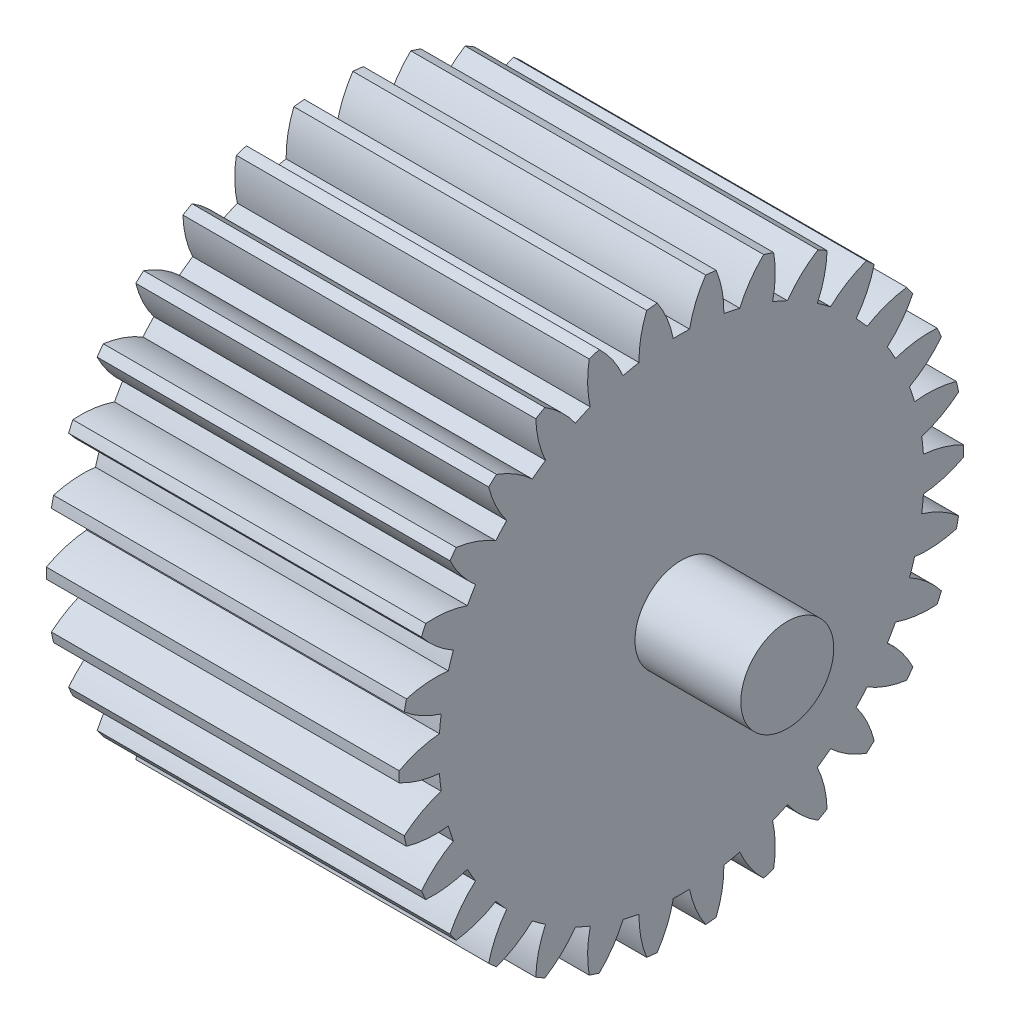
from build123d import *

# Parameters (mm, degrees)
BASPROSKE_W             = 20
BASPROSKE_H             = 24
TOOTHCUT_DEPTH          = 40.395431207
TEETHCUTS_COUNT         = 30
HUBNEABOTSKE_R          = 10
HUBNEARBOTH_DEPTH       = 10.0000254
HUBFAR_START            = 10.0000254
HUBFARSKE_R             = 10
HUBFAR_DEPTH            = 10.0000254
BORSKE_R                = 4
BORE_DEPTH              = 40.0000508
CROQUIS1_R              = 10
CORTAR_EXTRUIR1_DEPTH   = 10.0000254
CROQUIS3_R              = 4
SALIENTE_EXTRUIR1_DEPTH = 30.0000254
CROQUIS4_R              = 3.95
SALIENTE_EXTRUIR2_DEPTH = 9
CROQUIS5_R              = 11.088138116
CORTAR_EXTRUIR2_DEPTH   = 10.0000254
SALIENTE_EXTRUIR3_START = 10
SALIENTE_EXTRUIR3_DEPTH = 10
CROQUIS7_R              = 4
CROQUIS7_R_2            = 1.5
CORTAR_EXTRUIR3_DEPTH   = 10


with BuildPart() as part:
    # BasProSke → Base-Revolve (revolve)
    with BuildSketch(Plane(origin=(0, 0, 0), x_dir=(1, 0, 0), z_dir=(0, 1, 0)), mode=Mode.PRIVATE) as base_revolve_sk:
        with Locations((10, 12)):
            Rectangle(BASPROSKE_W, BASPROSKE_H)
    revolve(base_revolve_sk.sketch.rotate(Axis((-10, 0, 0), (1, 0, 0)), 180), axis=Axis((-10, 0, 0), (1, 0, 0)))

    # TooCutSke → ToothCut (cut, through all)
    with BuildSketch(Plane(origin=(0, 0, 0), x_dir=(0, 0, -1), z_dir=(1, 0, 0))):
        with BuildLine():
            ThreePointArc((0.693278797, 20.612344372), (0, 20.624), (-0.693278797, 20.612344372))
            ThreePointArc((-0.693278797, 20.612344372), (-1.219042225, 22.34383125), (-2.080549663, 23.935144835))
            ThreePointArc((-2.080549663, 23.935144835), (0, 24.0254), (2.080549663, 23.935144835))
            ThreePointArc((2.080549663, 23.935144835), (1.219042225, 22.34383125), (0.693278797, 20.612344372))
        make_face()
    toothcut = extrude(amount=TOOTHCUT_DEPTH, mode=Mode.SUBTRACT)

    # TeethCuts: ToothCut ×30 about axis
    teethcuts_axis = Axis((0, 0, 0), (1, 0, 0))
    for i in range(1, TEETHCUTS_COUNT):
        add(toothcut.rotate(teethcuts_axis, i * 360 / TEETHCUTS_COUNT), mode=Mode.SUBTRACT)

    # HubNeaBotSke → HubNearBoth (add)
    with BuildSketch(Plane.ZY):
        with Locations(Location((0, 0, 0), (0, 0, 180))):
            Circle(HUBNEABOTSKE_R)
    extrude(amount=HUBNEARBOTH_DEPTH)

    # HubFarSke → HubFar (add)
    with BuildSketch(Plane(origin=(20, 0, 0), x_dir=(0, 0, -1), z_dir=(1, 0, 0)).offset(HUBFAR_START)):
        Circle(HUBFARSKE_R)
    extrude(amount=-HUBFAR_DEPTH)

    # BorSke → Bore (cut, symmetric)
    with BuildSketch(Plane(origin=(0, 0, 0), x_dir=(0, 0, -1), z_dir=(1, 0, 0))):
        with Locations(Location((0, 0, 0), (0, 0, 180))):
            Circle(BORSKE_R)
    extrude(amount=BORE_DEPTH, both=True, mode=Mode.SUBTRACT)

    # Croquis1 → Cortar-Extruir1 (cut)
    with BuildSketch(Plane(origin=(30.0000254, 0, 0), x_dir=(0, 0, -1), z_dir=(1, 0, 0))):
        Circle(CROQUIS1_R)
    extrude(amount=-CORTAR_EXTRUIR1_DEPTH, mode=Mode.SUBTRACT)

    # Croquis3 → Saliente-Extruir1 (add)
    with BuildSketch(Plane(origin=(20, 0, 0), x_dir=(0, 0, -1), z_dir=(1, 0, 0))):
        Circle(CROQUIS3_R)
    extrude(amount=-SALIENTE_EXTRUIR1_DEPTH)

    # Croquis4 → Saliente-Extruir2 (add)
    with BuildSketch(Plane(origin=(20, 0, 0), x_dir=(0, 0, -1), z_dir=(1, 0, 0))):
        with Locations(Location((0, 0, 0), (0, 0, 180))):
            Circle(CROQUIS4_R)
    extrude(amount=SALIENTE_EXTRUIR2_DEPTH)

    # Croquis5 → Cortar-Extruir2 (cut)
    with BuildSketch(Plane.ZY.offset(10.0000254)):
        Circle(CROQUIS5_R)
    extrude(amount=-CORTAR_EXTRUIR2_DEPTH, mode=Mode.SUBTRACT)

    # Croquis6 → Saliente-Extruir3 (add)
    with BuildSketch(Plane.ZY.offset(SALIENTE_EXTRUIR3_START)):
        with BuildLine():
            ThreePointArc((20.57189516, -1.465095738), (22.334918489, -1.1273603), (23.995847106, -0.44645457))
            ThreePointArc((23.995847106, -0.44645457), (24, 0), (23.995847106, 0.44645457))
            ThreePointArc((23.995847106, 0.44645457), (22.334918489, 1.1273603), (20.57189516, 1.465095738))
            ThreePointArc((20.57189516, 1.465095738), (20.51101957, 2.155795026), (20.426960426, 2.844057625))
            ThreePointArc((20.426960426, 2.844057625), (22.081238318, 3.540965895), (23.564303398, 4.552318678))
            ThreePointArc((23.564303398, 4.552318678), (23.475542418, 4.98988058), (23.37865715, 5.42571561))
            ThreePointArc((23.37865715, 5.42571561), (21.612455546, 5.74641544), (19.817739361, 5.710217387))
            ThreePointArc((19.817739361, 5.710217387), (19.614589592, 6.373166492), (19.389269501, 7.028912022))
            ThreePointArc((19.389269501, 7.028912022), (20.862502076, 8.054534888), (22.102886559, 9.352133755))
            ThreePointArc((22.102886559, 9.352133755), (21.925090983, 9.761679434), (21.739707693, 10.167846844))
            ThreePointArc((21.739707693, 10.167846844), (19.945424588, 10.11432465), (18.197453256, 9.705775136))
            ThreePointArc((18.197453256, 9.705775136), (17.860907928, 10.312), (17.504174459, 10.906569236))
            ThreePointArc((17.504174459, 10.906569236), (18.731974384, 12.216082058), (19.675467515, 13.743215711))
            ThreePointArc((19.675467515, 13.743215711), (19.416407865, 14.106846055), (19.150628691, 14.465594379))
            ThreePointArc((19.150628691, 14.465594379), (17.406682867, 14.04018934), (15.781851123, 13.277143937))
            ThreePointArc((15.781851123, 13.277143937), (15.326618881, 13.800149626), (14.854062999, 14.307557039))
            ThreePointArc((14.854062999, 14.307557039), (15.782769525, 15.843727821), (16.388136127, 17.533653193))
            ThreePointArc((16.388136127, 17.533653193), (16.059134553, 17.835475811), (15.724575321, 18.131126026))
            ThreePointArc((15.724575321, 18.131126026), (14.107185578, 17.352430383), (12.676506366, 16.268237838))
            ThreePointArc((12.676506366, 16.268237838), (12.122483043, 16.685166492), (11.554757708, 17.083235943))
            ThreePointArc((11.554757708, 17.083235943), (12.143781903, 18.778926653), (12.384564552, 20.557785894))
            ThreePointArc((12.384564552, 20.557785894), (12, 20.784609691), (11.611282554, 21.004240464))
            ThreePointArc((11.611282554, 21.004240464), (10.191136586, 19.906286953), (9.017137452, 18.548331682))
            ThreePointArc((9.017137452, 18.548331682), (8.388536527, 18.840961518), (7.75045406, 19.112295463))
            ThreePointArc((7.75045406, 19.112295463), (7.97405274, 20.893396278), (7.839728078, 22.683444705))
            ThreePointArc((7.839728078, 22.683444705), (7.416407865, 22.825356391), (6.990521022, 22.959368803))
            ThreePointArc((6.990521022, 22.959368803), (5.829686022, 21.590143261), (4.963676362, 20.017774426))
            ThreePointArc((4.963676362, 20.017774426), (4.287970711, 20.173316118), (3.607418378, 20.30605596))
            ThreePointArc((3.607418378, 20.30605596), (3.455819209, 22.094724229), (2.952257867, 23.817728134))
            ThreePointArc((2.952257867, 23.817728134), (2.508683118, 23.868525489), (2.064240178, 23.911062555))
            ThreePointArc((2.064240178, 23.911062555), (1.213450205, 22.330406708), (0.693278797, 20.612344372))
            ThreePointArc((0.693278797, 20.612344372), (0, 20.624), (-0.693278797, 20.612344372))
            ThreePointArc((-0.693278797, 20.612344372), (-1.213450205, 22.330406708), (-2.064240178, 23.911062555))
            ThreePointArc((-2.064240178, 23.911062555), (-2.508683118, 23.868525489), (-2.952257867, 23.817728134))
            ThreePointArc((-2.952257867, 23.817728134), (-3.455819209, 22.094724229), (-3.607418378, 20.30605596))
            ThreePointArc((-3.607418378, 20.30605596), (-4.287970711, 20.173316118), (-4.963676362, 20.017774426))
            ThreePointArc((-4.963676362, 20.017774426), (-5.829686022, 21.590143261), (-6.990521022, 22.959368803))
            ThreePointArc((-6.990521022, 22.959368803), (-7.416407865, 22.825356391), (-7.839728078, 22.683444705))
            ThreePointArc((-7.839728078, 22.683444705), (-7.97405274, 20.893396278), (-7.75045406, 19.112295463))
            ThreePointArc((-7.75045406, 19.112295463), (-8.388536527, 18.840961518), (-9.017137452, 18.548331682))
            ThreePointArc((-9.017137452, 18.548331682), (-10.191136586, 19.906286953), (-11.611282554, 21.004240464))
            ThreePointArc((-11.611282554, 21.004240464), (-12, 20.784609691), (-12.384564552, 20.557785894))
            ThreePointArc((-12.384564552, 20.557785894), (-12.143781903, 18.778926653), (-11.554757708, 17.083235943))
            ThreePointArc((-11.554757708, 17.083235943), (-12.122483043, 16.685166492), (-12.676506366, 16.268237838))
            ThreePointArc((-12.676506366, 16.268237838), (-14.107185578, 17.352430383), (-15.724575321, 18.131126026))
            ThreePointArc((-15.724575321, 18.131126026), (-16.059134553, 17.835475811), (-16.388136127, 17.533653193))
            ThreePointArc((-16.388136127, 17.533653193), (-15.782769525, 15.843727821), (-14.854062999, 14.307557039))
            ThreePointArc((-14.854062999, 14.307557039), (-15.326618881, 13.800149626), (-15.781851123, 13.277143937))
            ThreePointArc((-15.781851123, 13.277143937), (-17.406682867, 14.04018934), (-19.150628691, 14.465594379))
            ThreePointArc((-19.150628691, 14.465594379), (-19.416407865, 14.106846055), (-19.675467515, 13.743215711))
            ThreePointArc((-19.675467515, 13.743215711), (-18.731974384, 12.216082058), (-17.504174459, 10.906569236))
            ThreePointArc((-17.504174459, 10.906569236), (-17.860907928, 10.312), (-18.197453256, 9.705775136))
            ThreePointArc((-18.197453256, 9.705775136), (-19.945424588, 10.11432465), (-21.739707693, 10.167846844))
            ThreePointArc((-21.739707693, 10.167846844), (-21.925090983, 9.761679434), (-22.102886559, 9.352133755))
            ThreePointArc((-22.102886559, 9.352133755), (-20.862502076, 8.054534888), (-19.389269501, 7.028912022))
            ThreePointArc((-19.389269501, 7.028912022), (-19.614589592, 6.373166492), (-19.817739361, 5.710217387))
            ThreePointArc((-19.817739361, 5.710217387), (-21.612455546, 5.74641544), (-23.37865715, 5.42571561))
            ThreePointArc((-23.37865715, 5.42571561), (-23.475542418, 4.98988058), (-23.564303398, 4.552318678))
            ThreePointArc((-23.564303398, 4.552318678), (-22.081238318, 3.540965895), (-20.426960426, 2.844057625))
            ThreePointArc((-20.426960426, 2.844057625), (-20.51101957, 2.155795026), (-20.57189516, 1.465095738))
            ThreePointArc((-20.57189516, 1.465095738), (-22.334918489, 1.1273603), (-23.995847106, 0.44645457))
            ThreePointArc((-23.995847106, 0.44645457), (-24, 0), (-23.995847106, -0.44645457))
            ThreePointArc((-23.995847106, -0.44645457), (-22.334918489, -1.1273603), (-20.57189516, -1.465095738))
            ThreePointArc((-20.57189516, -1.465095738), (-20.51101957, -2.155795026), (-20.426960426, -2.844057625))
            ThreePointArc((-20.426960426, -2.844057625), (-22.081238318, -3.540965895), (-23.564303398, -4.552318678))
            ThreePointArc((-23.564303398, -4.552318678), (-23.475542418, -4.98988058), (-23.37865715, -5.42571561))
            ThreePointArc((-23.37865715, -5.42571561), (-21.612455546, -5.74641544), (-19.817739361, -5.710217387))
            ThreePointArc((-19.817739361, -5.710217387), (-19.614589592, -6.373166492), (-19.389269501, -7.028912022))
            ThreePointArc((-19.389269501, -7.028912022), (-20.862502076, -8.054534888), (-22.102886559, -9.352133755))
            ThreePointArc((-22.102886559, -9.352133755), (-21.925090983, -9.761679434), (-21.739707693, -10.167846844))
            ThreePointArc((-21.739707693, -10.167846844), (-19.945424588, -10.11432465), (-18.197453256, -9.705775136))
            ThreePointArc((-18.197453256, -9.705775136), (-17.860907928, -10.312), (-17.504174459, -10.906569236))
            ThreePointArc((-17.504174459, -10.906569236), (-18.731974384, -12.216082058), (-19.675467515, -13.743215711))
            ThreePointArc((-19.675467515, -13.743215711), (-19.416407865, -14.106846055), (-19.150628691, -14.465594379))
            ThreePointArc((-19.150628691, -14.465594379), (-17.406682867, -14.04018934), (-15.781851123, -13.277143937))
            ThreePointArc((-15.781851123, -13.277143937), (-15.326618881, -13.800149626), (-14.854062999, -14.307557039))
            ThreePointArc((-14.854062999, -14.307557039), (-15.782769525, -15.843727821), (-16.388136127, -17.533653193))
            ThreePointArc((-16.388136127, -17.533653193), (-16.059134553, -17.835475811), (-15.724575321, -18.131126026))
            ThreePointArc((-15.724575321, -18.131126026), (-14.107185578, -17.352430383), (-12.676506366, -16.268237838))
            ThreePointArc((-12.676506366, -16.268237838), (-12.122483043, -16.685166492), (-11.554757708, -17.083235943))
            ThreePointArc((-11.554757708, -17.083235943), (-12.143781903, -18.778926653), (-12.384564552, -20.557785894))
            ThreePointArc((-12.384564552, -20.557785894), (-12, -20.784609691), (-11.611282554, -21.004240464))
            ThreePointArc((-11.611282554, -21.004240464), (-10.191136586, -19.906286953), (-9.017137452, -18.548331682))
            ThreePointArc((-9.017137452, -18.548331682), (-8.388536527, -18.840961518), (-7.75045406, -19.112295463))
            ThreePointArc((-7.75045406, -19.112295463), (-7.97405274, -20.893396278), (-7.839728078, -22.683444705))
            ThreePointArc((-7.839728078, -22.683444705), (-7.416407865, -22.825356391), (-6.990521022, -22.959368803))
            ThreePointArc((-6.990521022, -22.959368803), (-5.829686022, -21.590143261), (-4.963676362, -20.017774426))
            ThreePointArc((-4.963676362, -20.017774426), (-4.287970711, -20.173316118), (-3.607418378, -20.30605596))
            ThreePointArc((-3.607418378, -20.30605596), (-3.455819209, -22.094724229), (-2.952257867, -23.817728134))
            ThreePointArc((-2.952257867, -23.817728134), (-2.508683118, -23.868525489), (-2.064240178, -23.911062555))
            ThreePointArc((-2.064240178, -23.911062555), (-1.213450205, -22.330406708), (-0.693278797, -20.612344372))
            ThreePointArc((-0.693278797, -20.612344372), (0, -20.624), (0.693278797, -20.612344372))
            ThreePointArc((0.693278797, -20.612344372), (1.213450205, -22.330406708), (2.064240178, -23.911062555))
            ThreePointArc((2.064240178, -23.911062555), (2.508683118, -23.868525489), (2.952257867, -23.817728134))
            ThreePointArc((2.952257867, -23.817728134), (3.455819209, -22.094724229), (3.607418378, -20.30605596))
            ThreePointArc((3.607418378, -20.30605596), (4.287970711, -20.173316118), (4.963676362, -20.017774426))
            ThreePointArc((4.963676362, -20.017774426), (5.829686022, -21.590143261), (6.990521022, -22.959368803))
            ThreePointArc((6.990521022, -22.959368803), (7.416407865, -22.825356391), (7.839728078, -22.683444705))
            ThreePointArc((7.839728078, -22.683444705), (7.97405274, -20.893396278), (7.75045406, -19.112295463))
            ThreePointArc((7.75045406, -19.112295463), (8.388536527, -18.840961518), (9.017137452, -18.548331682))
            ThreePointArc((9.017137452, -18.548331682), (10.191136586, -19.906286953), (11.611282554, -21.004240464))
            ThreePointArc((11.611282554, -21.004240464), (12, -20.784609691), (12.384564552, -20.557785894))
            ThreePointArc((12.384564552, -20.557785894), (12.143781903, -18.778926653), (11.554757708, -17.083235943))
            ThreePointArc((11.554757708, -17.083235943), (12.122483043, -16.685166492), (12.676506366, -16.268237838))
            ThreePointArc((12.676506366, -16.268237838), (14.107185578, -17.352430383), (15.724575321, -18.131126026))
            ThreePointArc((15.724575321, -18.131126026), (16.059134553, -17.835475811), (16.388136127, -17.533653193))
            ThreePointArc((16.388136127, -17.533653193), (15.782769525, -15.843727821), (14.854062999, -14.307557039))
            ThreePointArc((14.854062999, -14.307557039), (15.326618881, -13.800149626), (15.781851123, -13.277143937))
            ThreePointArc((15.781851123, -13.277143937), (17.406682867, -14.04018934), (19.150628691, -14.465594379))
            ThreePointArc((19.150628691, -14.465594379), (19.416407865, -14.106846055), (19.675467515, -13.743215711))
            ThreePointArc((19.675467515, -13.743215711), (18.731974384, -12.216082058), (17.504174459, -10.906569236))
            ThreePointArc((17.504174459, -10.906569236), (17.860907928, -10.312), (18.197453256, -9.705775136))
            ThreePointArc((18.197453256, -9.705775136), (19.945424588, -10.11432465), (21.739707693, -10.167846844))
            ThreePointArc((21.739707693, -10.167846844), (21.925090983, -9.761679434), (22.102886559, -9.352133755))
            ThreePointArc((22.102886559, -9.352133755), (20.862502076, -8.054534888), (19.389269501, -7.028912022))
            ThreePointArc((19.389269501, -7.028912022), (19.614589592, -6.373166492), (19.817739361, -5.710217387))
            ThreePointArc((19.817739361, -5.710217387), (21.612455546, -5.74641544), (23.37865715, -5.42571561))
            ThreePointArc((23.37865715, -5.42571561), (23.475542418, -4.98988058), (23.564303398, -4.552318678))
            ThreePointArc((23.564303398, -4.552318678), (22.081238318, -3.540965895), (20.426960426, -2.844057625))
            ThreePointArc((20.426960426, -2.844057625), (20.51101957, -2.155795026), (20.57189516, -1.465095738))
        make_face()
    extrude(amount=-SALIENTE_EXTRUIR3_DEPTH)

    # Croquis7 → Cortar-Extruir3 (cut)
    with BuildSketch(Plane.ZY.offset(10)):
        Circle(CROQUIS7_R)
        with Locations((0, 10)):
            Circle(CROQUIS7_R_2)
        with Locations((10, 0)):
            Circle(CROQUIS7_R_2)
        with Locations((0, -10)):
            Circle(CROQUIS7_R_2)
        with Locations((-10, 0)):
            Circle(CROQUIS7_R_2)
    extrude(amount=-CORTAR_EXTRUIR3_DEPTH, mode=Mode.SUBTRACT)


solid = part.part
